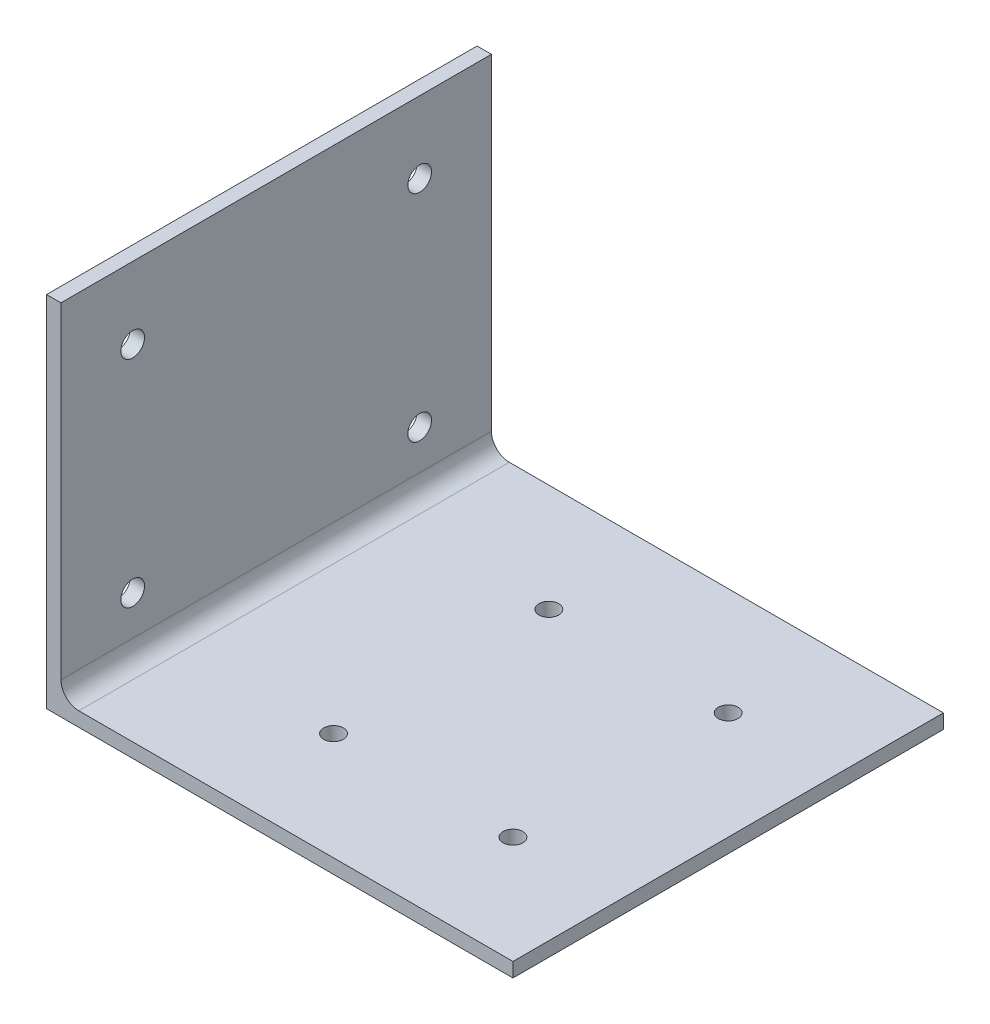
from build123d import *

# Parameters (mm, degrees)
BOSS_EXTRUDE1_DEPTH = 120
SKETCH4_R           = 3.3
CUT_EXTRUDE1_DEPTH  = 201.688813839
SKETCH5_R           = 2.75
CUT_EXTRUDE2_DEPTH  = 202.285866369
FILLET1_R           = 5


with BuildPart() as part:
    # Sketch2 → Boss-Extrude1 (new body)
    with BuildSketch(Plane.XY):
        Polygon((0, 0), (0, 100), (4, 100), (4, 4), (130, 4), (130, 0), align=None)
    extrude(amount=BOSS_EXTRUDE1_DEPTH)

    # Sketch4 → Cut-Extrude1 (cut, through all)
    with BuildSketch(Plane(origin=(4, 0, 0), x_dir=(0, 0, -1), z_dir=(1, 0, 0))):
        with Locations(Location((-100, 80, 0), (0, 0, 90))):
            Circle(SKETCH4_R)
        with Locations(Location((-20, 80, 0), (0, 0, 90))):
            Circle(SKETCH4_R)
        with Locations(Location((-20, 20, 0), (0, 0, 90))):
            Circle(SKETCH4_R)
        with Locations(Location((-100, 20, 0), (0, 0, 90))):
            Circle(SKETCH4_R)
    extrude(amount=-CUT_EXTRUDE1_DEPTH, mode=Mode.SUBTRACT)

    # Sketch5 → Cut-Extrude2 (cut, through all)
    with BuildSketch(Plane(origin=(0, 4, 0), x_dir=(1, 0, 0), z_dir=(0, 1, 0))):
        with Locations(Location((100, -30, 0), (0, 0, 180))):
            Circle(SKETCH5_R)
        with Locations(Location((50, -30, 0), (0, 0, 180))):
            Circle(SKETCH5_R)
        with Locations(Location((50, -90, 0), (0, 0, 180))):
            Circle(SKETCH5_R)
        with Locations(Location((100, -90, 0), (0, 0, 180))):
            Circle(SKETCH5_R)
    extrude(amount=-CUT_EXTRUDE2_DEPTH, mode=Mode.SUBTRACT)

    # Fillet1
    fillet1_edges = [part.edges().sort_by_distance(p)[0] for p in [
        (4, 4, 60),
    ]]
    fillet(fillet1_edges, radius=FILLET1_R)


solid = part.part
